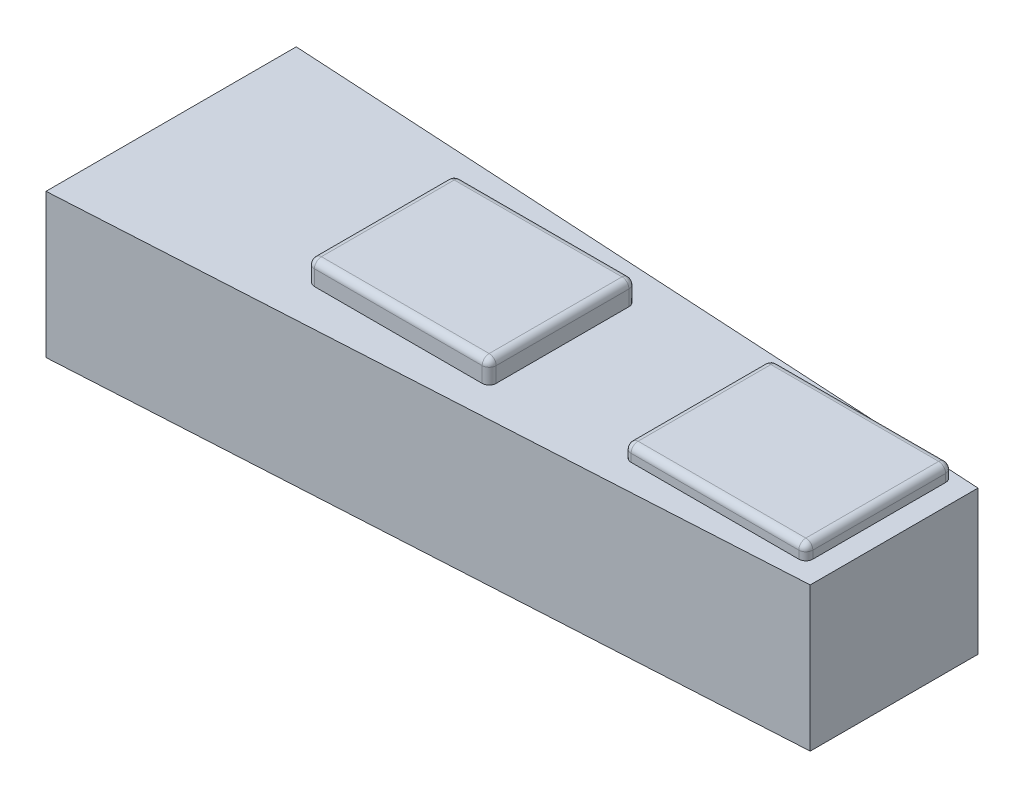
from build123d import *

# Parameters (mm, degrees)
BOSS_EXTRUDE1_DEPTH     = 103
FILLET1_R               = 0.0001
SKETCH2_W               = 130
SKETCH2_H               = 105
BOSS_EXTRUDE2_DEPTH     = 10.6
FILLET2_R               = 5
SKETCH3_W               = 130
SKETCH3_H               = 105
BOSS_EXTRUDE3_DEPTH     = 16
FILLET3_R               = 5
CUT_EXTRUDE1_DEPTH      = 539.168188348
CUT_EXTRUDE1_DEPTH_BACK = 104
SKETCH4_R               = 15
SKETCH5_R               = 15
CUT_EXTRUDE2_DEPTH      = 104


with BuildPart() as part:
    # Sketch1 → Boss-Extrude1 (new body)
    with BuildSketch(Plane(origin=(0, 0, 0), x_dir=(1, 0, 0), z_dir=(0, 1, 0))):
        Polygon((0, -89.5), (0, 89.5), (517.159308144, 60), (517.159308144, -60), align=None)
    extrude(amount=BOSS_EXTRUDE1_DEPTH)

    # Fillet1
    fillet1_edges = [part.edges().sort_by_distance(p)[0] for p in [
        (0, 0, 0),
        (0, 51.5, -89.5),
        (258.579654072, 0, -74.75),
        (517.159308144, 51.5, -60),
        (517.159308144, 0, 0),
        (517.159308144, 51.5, 60),
        (258.579654072, 0, 74.75),
        (0, 51.5, 89.5),
        (0, 103, 0),
        (517.159308144, 103, 0),
        (258.579654072, 103, -74.75),
        (258.579654072, 103, 74.75),
    ]]
    fillet(fillet1_edges, radius=FILLET1_R)

    # Sketch2 → Boss-Extrude2 (add)
    with BuildSketch(Plane(origin=(0, 103, 0), x_dir=(1, 0, 0), z_dir=(0, 1, 0))):
        with Locations((437.159208144, 4.349038924)):
            Rectangle(SKETCH2_W, SKETCH2_H)
    extrude(amount=BOSS_EXTRUDE2_DEPTH)

    # Fillet2
    fillet2_edges = [part.edges().sort_by_distance(p)[0] for p in [
        (502.159208144, 108.3, 48.150961076),
        (502.159208144, 108.3, -56.849038924),
        (372.159208144, 108.3, -56.849038924),
        (372.159208144, 108.3, 48.150961076),
        (502.159208144, 113.6, -4.349038924),
        (437.159208144, 113.6, -56.849038924),
        (372.159208144, 113.6, -4.349038924),
        (437.159208144, 113.6, 48.150961076),
    ]]
    fillet(fillet2_edges, radius=FILLET2_R)

    # Sketch3 → Boss-Extrude3 (add)
    with BuildSketch(Plane(origin=(0, 103, 0), x_dir=(1, 0, 0), z_dir=(0, 1, 0))):
        with Locations((215.0001, 0)):
            Rectangle(SKETCH3_W, SKETCH3_H)
    extrude(amount=BOSS_EXTRUDE3_DEPTH)

    # Fillet3
    fillet3_edges = [part.edges().sort_by_distance(p)[0] for p in [
        (280.0001, 111, 52.5),
        (280.0001, 111, -52.5),
        (150.0001, 111, -52.5),
        (150.0001, 111, 52.5),
        (280.0001, 119, 0),
        (215.0001, 119, -52.5),
        (150.0001, 119, 0),
        (215.0001, 119, 52.5),
    ]]
    fillet(fillet3_edges, radius=FILLET3_R)

    # Sketch4 → Cut-Extrude1 (cut, two sides: drawn at the far end of the back side and taken through both)
    with BuildSketch(Plane.XZ.offset(-CUT_EXTRUDE1_DEPTH_BACK)):
        with Locations(Location((479.159308144, 0, 0), (0, 0, 90))):
            Circle(SKETCH4_R)
    extrude(amount=CUT_EXTRUDE1_DEPTH + CUT_EXTRUDE1_DEPTH_BACK, mode=Mode.SUBTRACT)

    # Sketch5 → Cut-Extrude2 (cut)
    with BuildSketch(Plane.XZ):
        with Locations(Location((255, 0, 0), (0, 0, 270))):
            Circle(SKETCH5_R)
    extrude(amount=-CUT_EXTRUDE2_DEPTH, mode=Mode.SUBTRACT)


solid = part.part
